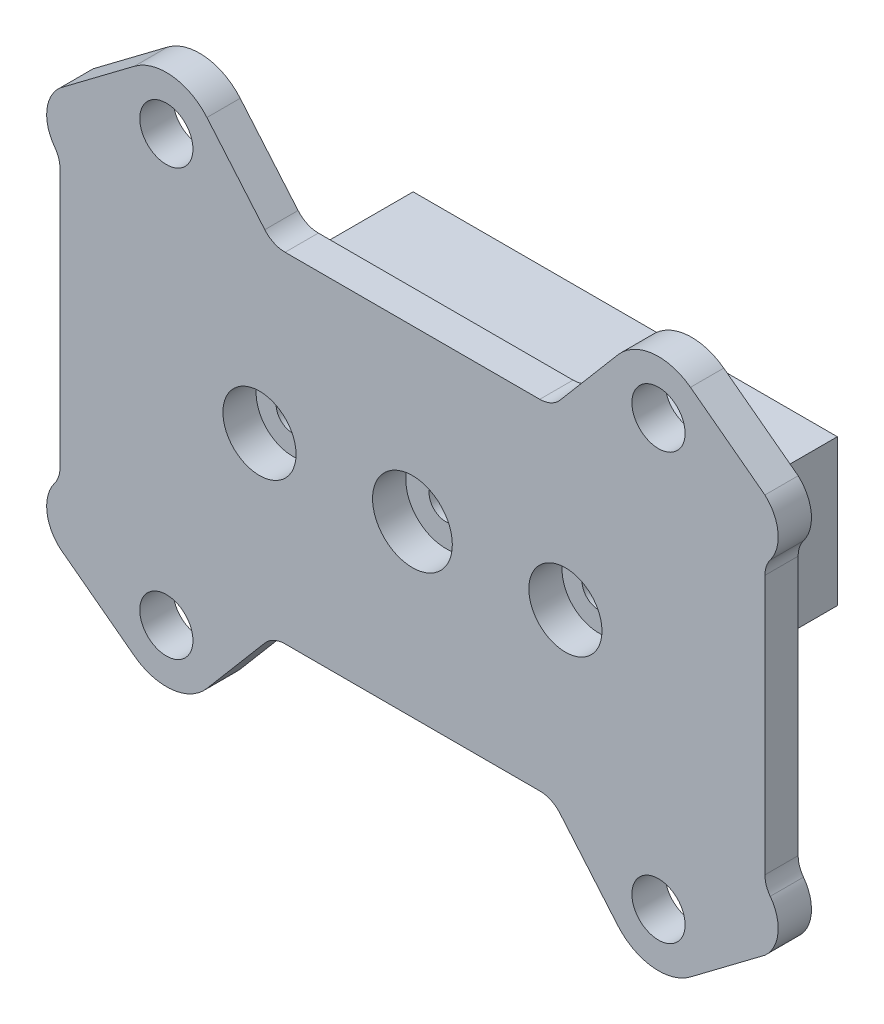
from build123d import *

# Parameters (mm, degrees)
SKETCH1_RX              = 2
SKETCH1_RY              = 2
BOSS_EXTRUDE1_DEPTH     = 2.5
SKETCH14_W              = 31.891524792
SKETCH14_H              = 10.99995058
BOSS_EXTRUDE9_DEPTH     = 13.5
CUT_EXTRUDE2_DEPTH      = 142.15856284
CUT_EXTRUDE2_DEPTH_BACK = 142.15856284
SKETCH12_R              = 1.25
FILLET9_R               = 6
SKETCH15_R              = 2.75
SKETCH15_R_2            = 3
CUT_EXTRUDE3_DEPTH      = 2.5


with BuildPart() as part:
    # Sketch1 → Boss-Extrude1 (new body)
    with BuildSketch(Plane.XY):
        with BuildLine():
            Line((-97.997023968, -1.656563984), (-93.647036265, -6.786872031))
            ThreePointArc((-93.647036265, -6.786872031), (-91.040064157, -8.175287806), (-88.191031172, -7.396177424))
            Line((-88.191031172, -7.396177424), (-82.596119502, -3.186067977))
            ThreePointArc((-82.596119502, -3.186067977), (-81.610744956, -1.2458696), (-82.196119502, 0.85))
            ThreePointArc((-82.196119502, 0.85), (-82.493486098, 1.417544468), (-82.596119502, 2.05))
            Line((-82.596119502, 2.05), (-82.596119502, 21.55))
            ThreePointArc((-82.596119502, 21.55), (-82.493486098, 22.182455532), (-82.196119502, 22.75))
            ThreePointArc((-82.196119502, 22.75), (-81.610744956, 24.8458696), (-82.596119502, 26.786067977))
            Line((-82.596119502, 26.786067977), (-88.191031172, 30.996177424))
            ThreePointArc((-88.191031172, 30.996177424), (-91.040064157, 31.775287806), (-93.647036265, 30.386872031))
            Line((-93.647036265, 30.386872031), (-97.997023968, 25.256563984))
            ThreePointArc((-97.997023968, 25.256563984), (-98.681908745, 24.735217364), (-99.522482349, 24.55))
            Line((-99.522482349, 24.55), (-118.669756656, 24.55))
            ThreePointArc((-118.669756656, 24.55), (-119.51033026, 24.735217364), (-120.195215037, 25.256563984))
            Line((-120.195215037, 25.256563984), (-124.54520274, 30.386872031))
            ThreePointArc((-124.54520274, 30.386872031), (-127.152174848, 31.775287806), (-130.001207832, 30.996177424))
            Line((-130.001207832, 30.996177424), (-135.596119502, 26.786067977))
            ThreePointArc((-135.596119502, 26.786067977), (-136.581494048, 24.8458696), (-135.996119502, 22.75))
            ThreePointArc((-135.996119502, 22.75), (-135.698752906, 22.182455532), (-135.596119502, 21.55))
            Line((-135.596119502, 21.55), (-135.596119502, 2.05))
            ThreePointArc((-135.596119502, 2.05), (-135.698752906, 1.417544468), (-135.996119502, 0.85))
            ThreePointArc((-135.996119502, 0.85), (-136.581494048, -1.2458696), (-135.596119502, -3.186067977))
            Line((-135.596119502, -3.186067977), (-130.001207832, -7.396177424))
            ThreePointArc((-130.001207832, -7.396177424), (-127.152174848, -8.175287806), (-124.54520274, -6.786872031))
            Line((-124.54520274, -6.786872031), (-120.195215037, -1.656563984))
            ThreePointArc((-120.195215037, -1.656563984), (-119.51033026, -1.135217364), (-118.669756656, -0.95))
            Line((-118.669756656, -0.95), (-99.522482349, -0.95))
            ThreePointArc((-99.522482349, -0.95), (-98.681908745, -1.135217364), (-97.997023968, -1.656563984))
        make_face()
        with Locations(Location((-90.596119502, 27.8), (0, 0, 61.223751036))):
            Ellipse(SKETCH1_RX, SKETCH1_RY, mode=Mode.SUBTRACT)
        with Locations(Location((-127.596119502, 27.8), (0, 0, -118.776248964))):
            Ellipse(SKETCH1_RX, SKETCH1_RY, mode=Mode.SUBTRACT)
        with Locations(Location((-127.596119502, -4.2), (0, 0, -118.776248964))):
            Ellipse(SKETCH1_RX, SKETCH1_RY, mode=Mode.SUBTRACT)
        with Locations(Location((-90.596119502, -4.2), (0, 0, -28.776248964))):
            Ellipse(SKETCH1_RX, SKETCH1_RY, mode=Mode.SUBTRACT)
    extrude(amount=BOSS_EXTRUDE1_DEPTH)

    # Sketch14 → Boss-Extrude9 (add)
    with BuildSketch(Plane(origin=(0, 0, 0), x_dir=(-1, 0, 0), z_dir=(0, 0, -1))):
        with Locations((109.096119502, 11.8)):
            Rectangle(SKETCH14_W, SKETCH14_H)
    extrude(amount=BOSS_EXTRUDE9_DEPTH)

    # Sketch12 → Cut-Extrude2 (cut, two sides: drawn at the far end of the back side and taken through both)
    with BuildSketch(Plane.XY.offset(2.5).offset(-CUT_EXTRUDE2_DEPTH_BACK)):
        with Locations((-97.596119502, 11.8)):
            Circle(SKETCH12_R)
        with Locations((-120.596119502, 11.8)):
            Circle(SKETCH12_R)
        with Locations((-109.096119502, 11.8)):
            Circle(SKETCH12_R)
    extrude(amount=CUT_EXTRUDE2_DEPTH + CUT_EXTRUDE2_DEPTH_BACK, mode=Mode.SUBTRACT)

    # Fillet9
    fillet9_edges = [part.edges().sort_by_distance(p)[0] for p in [
        (-93.150357106, 11.8, 0),
        (-109.096119502, 6.30002471, 0),
        (-125.041881898, 11.8, 0),
        (-109.096119502, 17.29997529, 0),
    ]]
    fillet(fillet9_edges, radius=FILLET9_R)

    # Sketch15 → Cut-Extrude3 (cut)
    with BuildSketch(Plane.XY.offset(2.5)):
        with Locations((-120.596119502, 11.8)):
            Circle(SKETCH15_R)
        with Locations((-109.096119502, 11.8)):
            Circle(SKETCH15_R_2)
        with Locations((-97.596119502, 11.8)):
            Circle(SKETCH15_R)
    extrude(amount=-CUT_EXTRUDE3_DEPTH, mode=Mode.SUBTRACT)


solid = part.part
